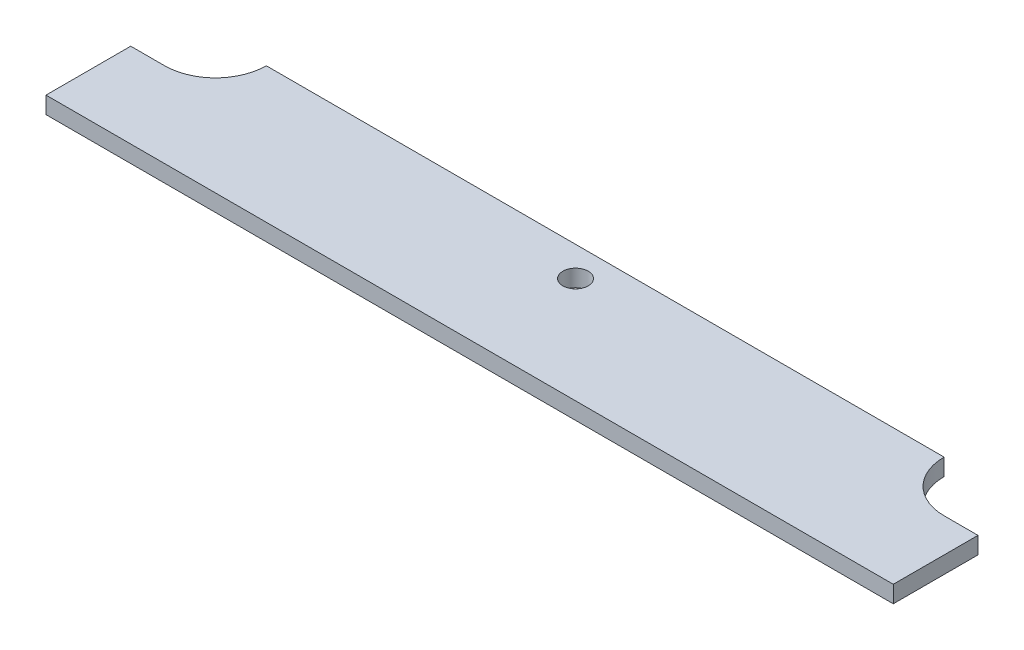
from build123d import *

# Parameters (mm, degrees)
SKETCH1_W           = 635
SKETCH1_H           = 101.6
BOSS_EXTRUDE1_DEPTH = 12.7
CUT_EXTRUDE1_DEPTH  = 322.789030267
SKETCH3_R           = 9.525
CUT_EXTRUDE2_DEPTH  = 322.789030267


with BuildPart() as part:
    # Sketch1 → Boss-Extrude1 (new body)
    with BuildSketch(Plane(origin=(0, 0, 0), x_dir=(1, 0, 0), z_dir=(0, 1, 0))):
        Rectangle(SKETCH1_W, SKETCH1_H)
    extrude(amount=BOSS_EXTRUDE1_DEPTH)

    # Sketch2 → Cut-Extrude1 (cut, through all)
    with BuildSketch(Plane(origin=(0, 12.7, 0), x_dir=(1, 0, 0), z_dir=(0, 1, 0))):
        with BuildLine():
            Line((-292.1, 12.7), (-317.5, 12.7))
            Line((-317.5, 12.7), (-317.5, 50.8))
            Line((-317.5, 50.8), (-254, 50.8))
            ThreePointArc((-254, 50.8), (-265.159231637, 23.859231637), (-292.1, 12.7))
        make_face()
    cut_extrude1 = extrude(amount=-CUT_EXTRUDE1_DEPTH, mode=Mode.SUBTRACT)

    # Mirror1: Cut-Extrude1 across plane
    add(cut_extrude1.mirror(Plane(origin=(0, 0, 0), x_dir=(0, 0, 1), z_dir=(1, 0, 0))), mode=Mode.SUBTRACT)

    # Sketch3 → Cut-Extrude2 (cut, through all)
    with BuildSketch(Plane(origin=(0, 12.7, 0), x_dir=(1, 0, 0), z_dir=(0, 1, 0))):
        with Locations(Location((0, 28.575, 0), (0, 0, 270))):
            Circle(SKETCH3_R)
    extrude(amount=-CUT_EXTRUDE2_DEPTH, mode=Mode.SUBTRACT)


solid = part.part
